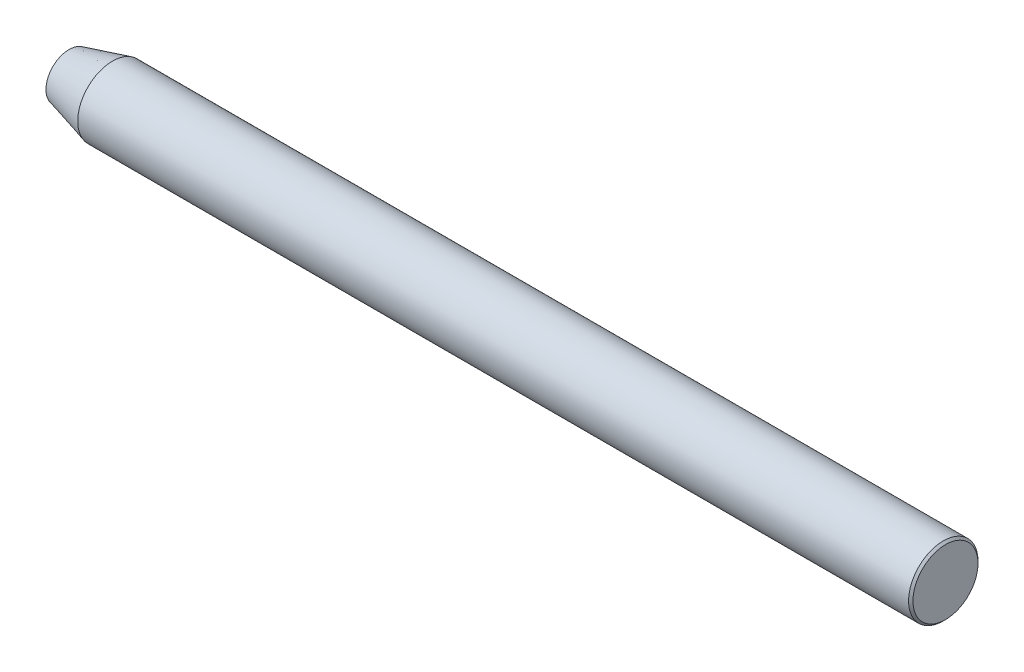
from build123d import *


with BuildPart() as part:
    # Sketch1 → Revolve1 (revolve)
    with BuildSketch(Plane.XY, mode=Mode.PRIVATE) as revolve1_sk:
        Polygon((0, 5.320508076), (0, 0), (202, 0), (202, 7.5), (201.5, 8), (10, 8), align=None)
    revolve(revolve1_sk.sketch.rotate(Axis((-0.005, 0, 0), (1, 0, 0)), 270), axis=Axis((-0.005, 0, 0), (1, 0, 0)))


solid = part.part
